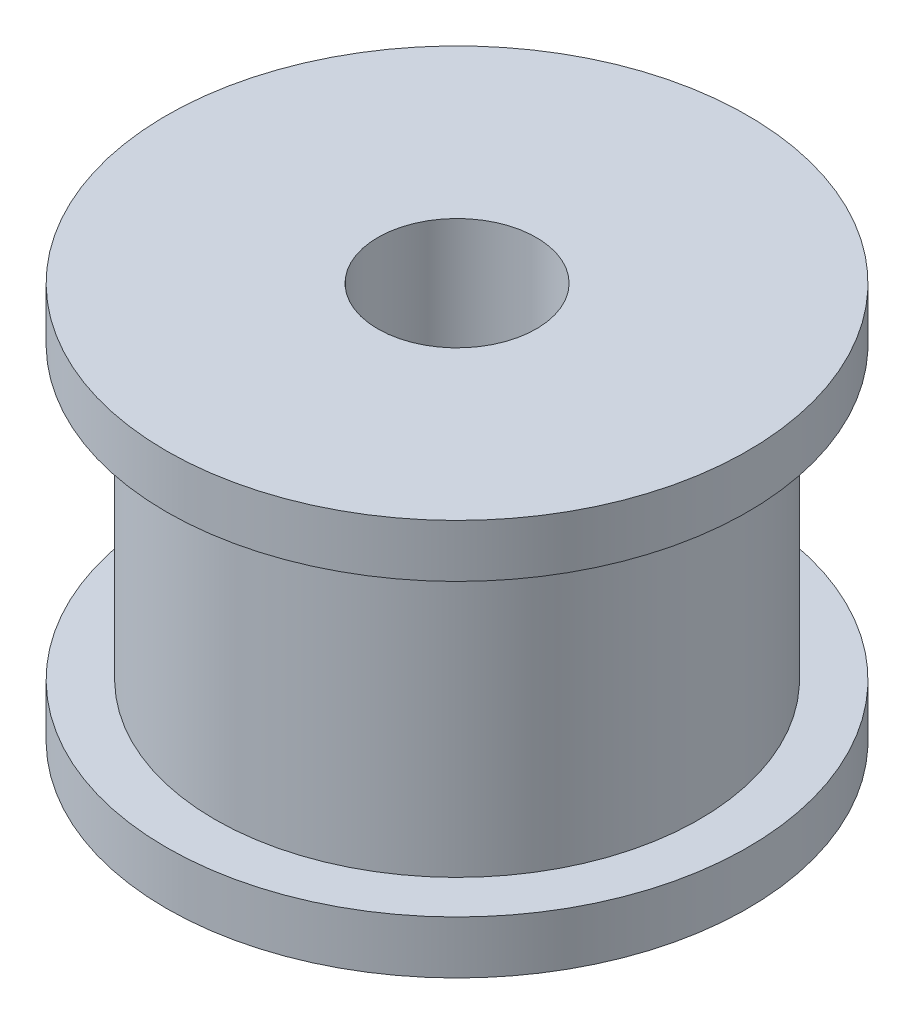
from build123d import *

# Parameters (mm, degrees)
SKETCH_1_R          = 11
SKETCH_1_R_2        = 3
EXTRUDE_1_DEPTH     = 15
CUT_EXTRUDE_START   = 2
SKETCH_2_R          = 11
SKETCH_2_R_2        = 9.165
CUT_EXTRUDE_1_DEPTH = 11


with BuildPart() as part:
    # 草图1 → 凸台-拉伸1 (new body)
    with BuildSketch(Plane(origin=(0, 0, 0), x_dir=(1, 0, 0), z_dir=(0, 1, 0))):
        with Locations(Location((0, 0, 0), (0, 0, 270))):
            Circle(SKETCH_1_R)
        with Locations(Location((0, 0, 0), (0, 0, 270))):
            Circle(SKETCH_1_R_2, mode=Mode.SUBTRACT)
    extrude(amount=EXTRUDE_1_DEPTH)

    # 草图2 → 切除-拉伸1 (cut)
    with BuildSketch(Plane(origin=(0, 0, 0), x_dir=(1, 0, 0), z_dir=(0, 1, 0)).offset(CUT_EXTRUDE_START)):
        with Locations(Location((0, 0, 0), (0, 0, 270))):
            Circle(SKETCH_2_R)
        with Locations(Location((0, 0, 0), (0, 0, 270))):
            Circle(SKETCH_2_R_2, mode=Mode.SUBTRACT)
    extrude(amount=CUT_EXTRUDE_1_DEPTH, mode=Mode.SUBTRACT)


solid = part.part
